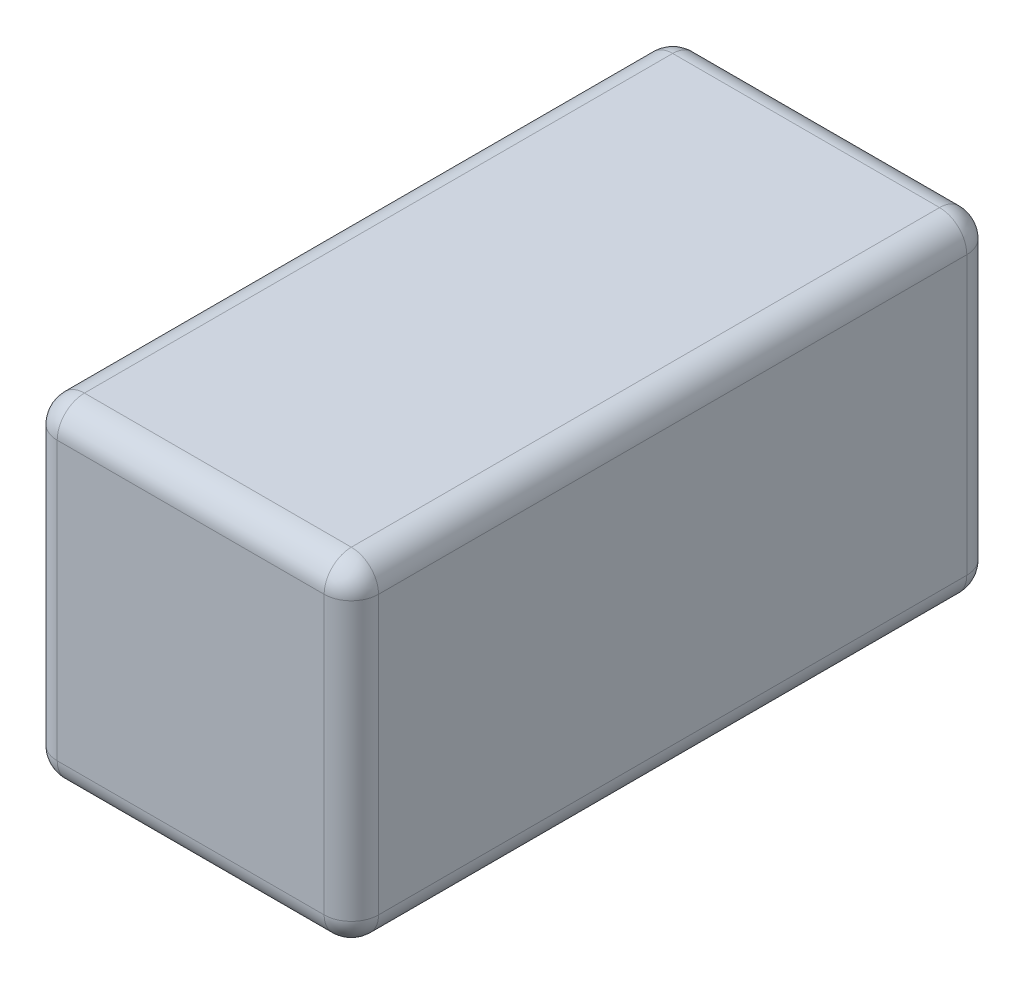
from build123d import *

# Parameters (mm, degrees)
SKETCH1_W           = 30
SKETCH1_H           = 31
BOSS_EXTRUDE1_DEPTH = 60
FILLET1_R           = 2.54


with BuildPart() as part:
    # Sketch1 → Boss-Extrude1 (new body)
    with BuildSketch(Plane.XY):
        Rectangle(SKETCH1_W, SKETCH1_H)
    extrude(amount=BOSS_EXTRUDE1_DEPTH)

    # Fillet1
    fillet1_edges = [part.edges().sort_by_distance(p)[0] for p in [
        (15, 0, 60),
        (0, 15.5, 60),
        (-15, 0, 60),
        (0, 15.5, 0),
        (15, 0, 0),
        (0, -15.5, 0),
        (-15, 0, 0),
        (0, -15.5, 60),
        (-15, 15.5, 30),
        (15, 15.5, 30),
        (15, -15.5, 30),
        (-15, -15.5, 30),
    ]]
    fillet(fillet1_edges, radius=FILLET1_R)


solid = part.part
